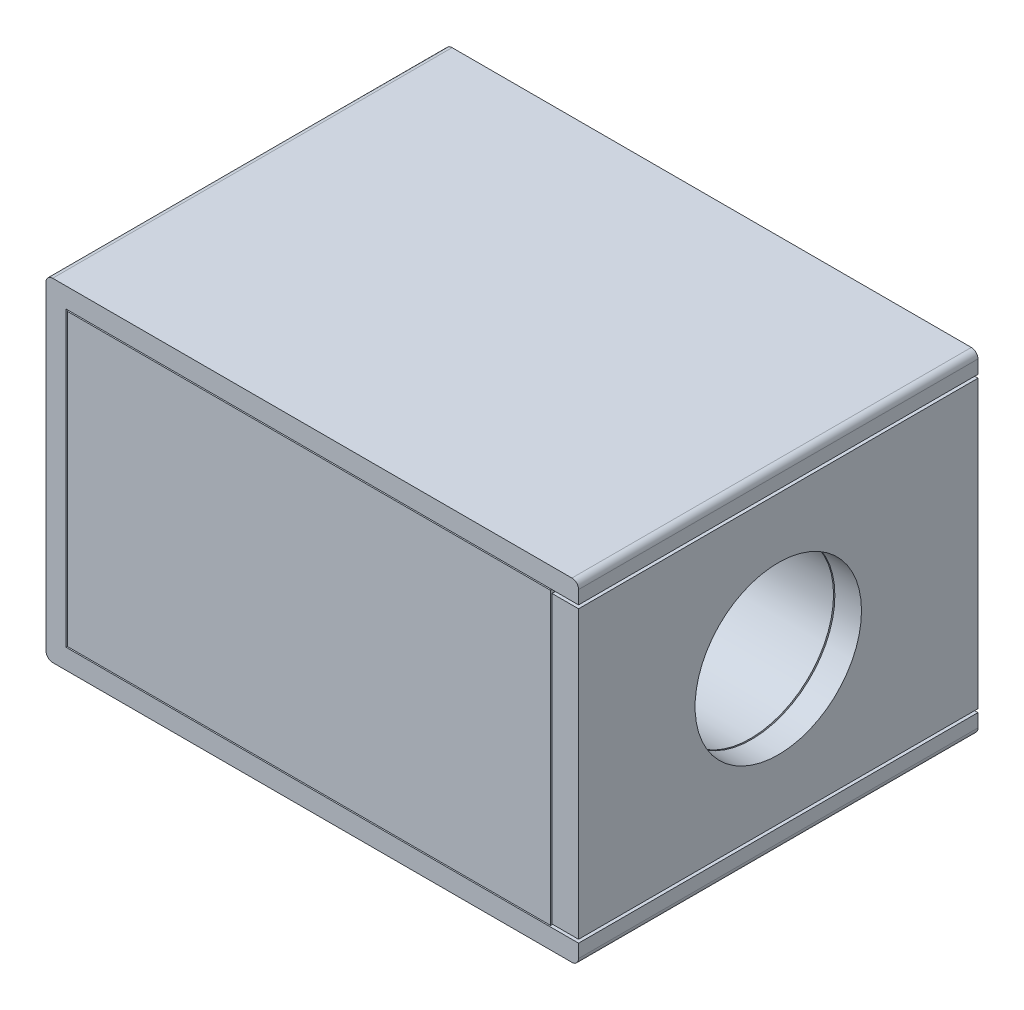
from build123d import *

# Parameters (mm, degrees)
BOSS_EXTRUDE1_DEPTH = 60
SKETCH2_W           = 60
SKETCH2_H           = 43
BOSS_EXTRUDE2_DEPTH = 4
SKETCH3_W           = 72.6
SKETCH3_H           = 43.6
BOSS_EXTRUDE3_DEPTH = 60
SKETCH4_R           = 2
CUT_EXTRUDE1_DEPTH  = 28
SKETCH5_R           = 12.5
CUT_EXTRUDE2_DEPTH  = 60
SKETCH6_R           = 5
CUT_EXTRUDE3_DEPTH  = 42


with BuildPart() as part:
    # Sketch1 → Boss-Extrude1 (new body)
    with BuildSketch(Plane.XY):
        with BuildLine():
            Line((0, -24), (0, 24))
            ThreePointArc((0, 24), (0.292893219, 24.707106781), (1, 25))
            Line((1, 25), (79, 25))
            ThreePointArc((79, 25), (79.707106781, 24.707106781), (80, 24))
            Line((80, 24), (80, 22))
            Line((80, 22), (3, 22))
            Line((3, 22), (3, -22))
            Line((3, -22), (80, -22))
            Line((80, -22), (80, -24))
            ThreePointArc((80, -24), (79.707106781, -24.707106781), (79, -25))
            Line((79, -25), (1, -25))
            ThreePointArc((1, -25), (0.292893219, -24.707106781), (0, -24))
        make_face()
    extrude(amount=BOSS_EXTRUDE1_DEPTH)


with BuildPart() as body_2:
    # Sketch2 → Boss-Extrude2 (new body)
    with BuildSketch(Plane(origin=(80, 0, 0), x_dir=(0, 0, -1), z_dir=(1, 0, 0))):
        with Locations((-30, 0)):
            Rectangle(SKETCH2_W, SKETCH2_H)
    extrude(amount=-BOSS_EXTRUDE2_DEPTH)


with BuildPart() as body_3:
    # Sketch3 → Boss-Extrude3 (new body)
    with BuildSketch(Plane.XY.offset(60)):
        with Locations((39.5, 0)):
            Rectangle(SKETCH3_W, SKETCH3_H)
    extrude(amount=-BOSS_EXTRUDE3_DEPTH)


with BuildPart() as cut_extrude1_tool:
    # Sketch4 → Cut-Extrude1 (new body)
    with BuildSketch(Plane.XZ.offset(25)):
        with Locations((17, 48.5)):
            Circle(SKETCH4_R)
        with Locations((45, 48.5)):
            Circle(SKETCH4_R)
        with Locations((45, 11.5)):
            Circle(SKETCH4_R)
        with Locations((17, 11.5)):
            Circle(SKETCH4_R)
    extrude(amount=-CUT_EXTRUDE1_DEPTH)


with BuildPart() as part_1:
    add(part.part)

    # Cut-Extrude1: cut by cut_extrude1_tool
    add(cut_extrude1_tool.part, mode=Mode.SUBTRACT)


with BuildPart() as body_3_1:
    add(body_3.part)

    # Cut-Extrude1: cut by cut_extrude1_tool
    add(cut_extrude1_tool.part, mode=Mode.SUBTRACT)


with BuildPart() as cut_extrude2_tool:
    # Sketch5 → Cut-Extrude2 (new body)
    with BuildSketch(Plane(origin=(80, 0, 0), x_dir=(0, 0, -1), z_dir=(1, 0, 0))):
        with Locations((-30, 0)):
            Circle(SKETCH5_R)
    extrude(amount=-CUT_EXTRUDE2_DEPTH)


with BuildPart() as body_2_1:
    add(body_2.part)

    # Cut-Extrude2: cut by cut_extrude2_tool
    add(cut_extrude2_tool.part, mode=Mode.SUBTRACT)


with BuildPart() as body_3_2:
    add(body_3_1.part)

    # Cut-Extrude2: cut by cut_extrude2_tool
    add(cut_extrude2_tool.part, mode=Mode.SUBTRACT)


with BuildPart() as cut_extrude3_tool:
    # Sketch6 → Cut-Extrude3 (new body)
    with BuildSketch(Plane.ZY):
        with Locations(Location((30, 0, 0), (0, 0, 270))):
            Circle(SKETCH6_R)
    extrude(amount=-CUT_EXTRUDE3_DEPTH)


with BuildPart() as part_2:
    add(part_1.part)

    # Cut-Extrude3: cut by cut_extrude3_tool
    add(cut_extrude3_tool.part, mode=Mode.SUBTRACT)


with BuildPart() as body_3_3:
    add(body_3_2.part)

    # Cut-Extrude3: cut by cut_extrude3_tool
    add(cut_extrude3_tool.part, mode=Mode.SUBTRACT)


solid = Compound([body_2_1.part, part_2.part, body_3_3.part])
